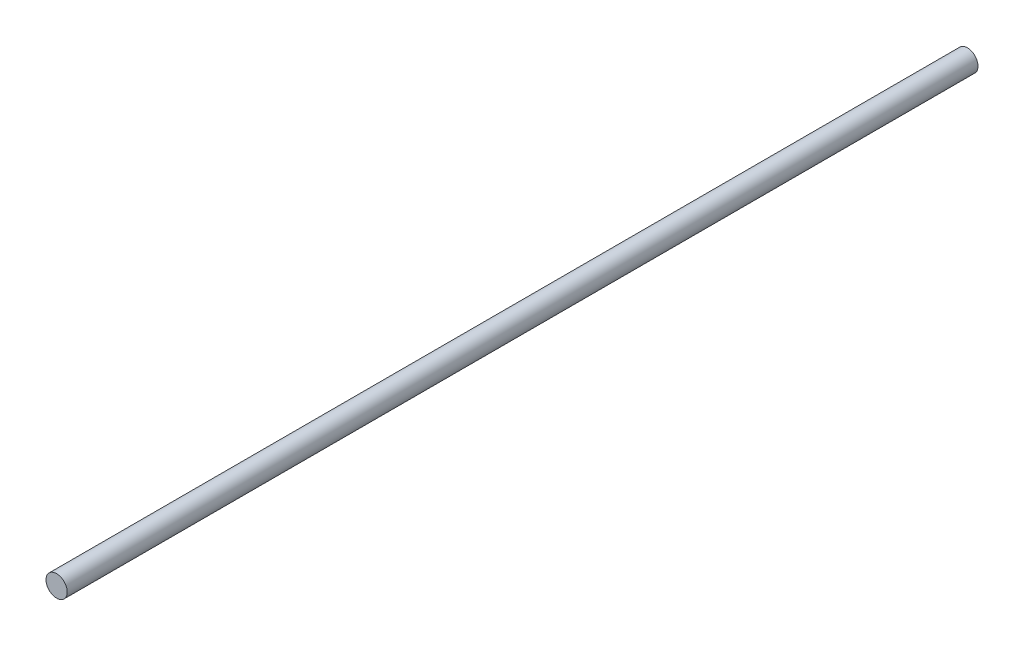
from build123d import *

# Parameters (mm, degrees)
SKETCH2_R           = 17.5
BOSS_EXTRUDE1_DEPTH = 1500


with BuildPart() as part:
    # Sketch2 → Boss-Extrude1 (new body)
    with BuildSketch(Plane.XY):
        Circle(SKETCH2_R)
    extrude(amount=-BOSS_EXTRUDE1_DEPTH)


solid = part.part
